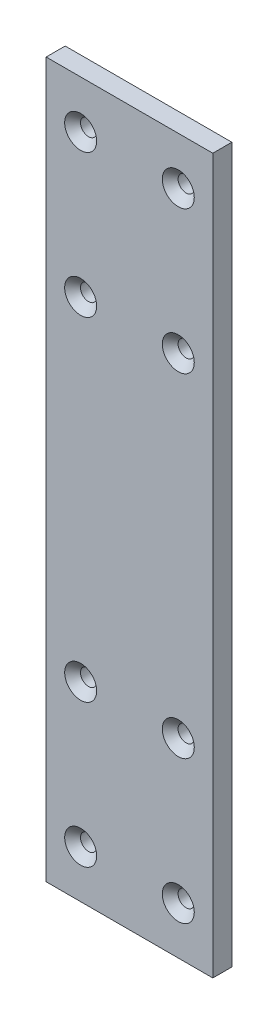
from build123d import *

# Parameters (mm, degrees)
SKETCH_1_W                   = 35
SKETCH_1_H                   = 150
EXTRUDE_1_DEPTH              = 4
HOLE_WIZARD_M3_1_D           = 3.4
HOLE_WIZARD_M3_1_CSINK_D     = 6.72
HOLE_WIZARD_M3_1_CSINK_ANGLE = 90


with BuildPart() as part:
    # 草图1 → 凸台-拉伸1 (new body)
    with BuildSketch(Plane.XY):
        Rectangle(SKETCH_1_W, SKETCH_1_H)
    extrude(amount=EXTRUDE_1_DEPTH)

    # M3 六角凹锥坑螺钉的锥形沉头孔1 (through all)
    with Locations(Plane(origin=(-10.25, -35, 4), x_dir=(1, 0, 0), z_dir=(0, 0, 1))):
        with Locations((0, 0), (20.5, 0), (20.5, -30), (0, -30), (0, 100), (20.5, 100), (20.5, 70), (0, 70)):
            CounterSinkHole(HOLE_WIZARD_M3_1_D / 2, HOLE_WIZARD_M3_1_CSINK_D / 2, counter_sink_angle=HOLE_WIZARD_M3_1_CSINK_ANGLE)


solid = part.part
